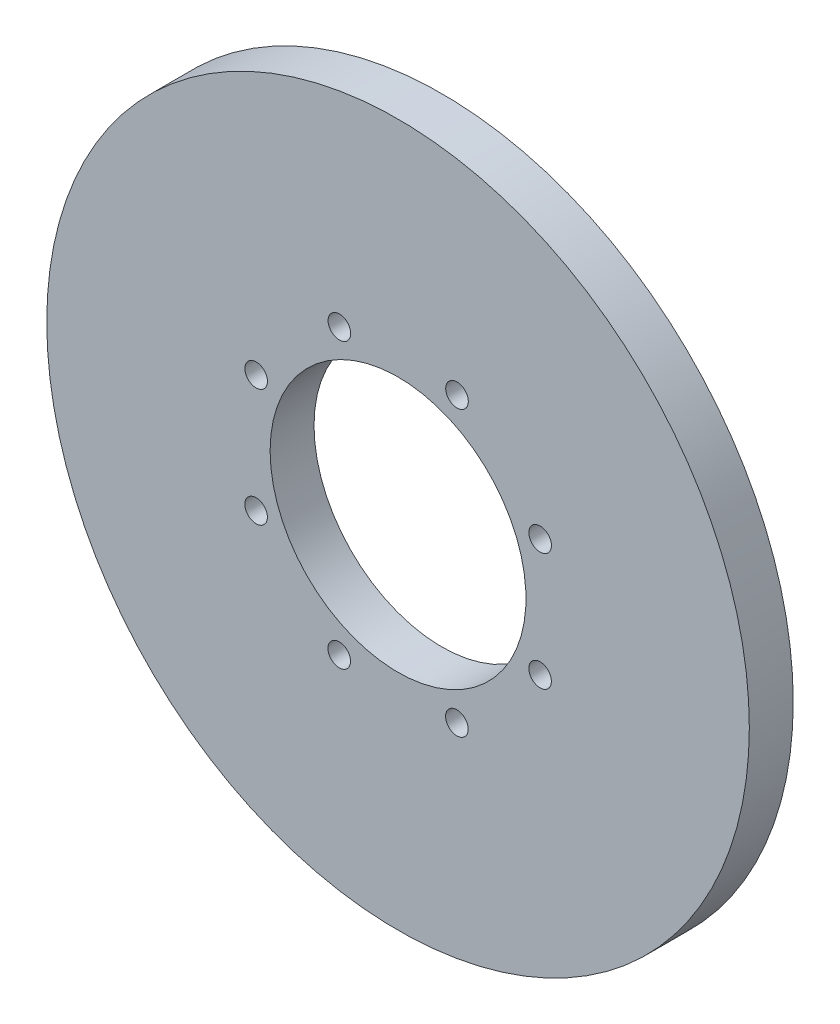
from build123d import *

# Parameters (mm, degrees)
SKETCH1_R                  = 152.4
BOSS_EXTRUDE1_DEPTH        = 19.05
SKETCH5_R                  = 55
CUT_EXTRUDE1_DEPTH         = 217.366407975
F_3_8_CLEARANCE_HOLE1_D    = 9.8044
NIPPLE_SOCKET_CLEARANCE_BY = 0.5


with BuildPart() as part:
    # Sketch1 → Boss-Extrude1 (new body)
    with BuildSketch(Plane.XY):
        with Locations(Location((0, 0, 0), (0, 0, 180))):
            Circle(SKETCH1_R)
    extrude(amount=BOSS_EXTRUDE1_DEPTH)

    # Sketch5 → Cut-Extrude1 (cut, through all)
    with BuildSketch(Plane(origin=(0, 0, 0), x_dir=(-1, 0, 0), z_dir=(0, 0, -1))):
        Circle(SKETCH5_R)
    extrude(amount=-CUT_EXTRUDE1_DEPTH, mode=Mode.SUBTRACT)

    # 3/8 Clearance Hole1 (through all)
    with Locations(Plane.XY.offset(19.05)):
        with Locations((25.523973959, -61.673028045), (61.624734649, -25.605296339), (61.648089668, 25.425534023), (25.580357962, 61.526294713), (-25.450472399, 61.549649732), (-61.55123309, 25.481918026), (-61.574588109, -25.548912335), (-25.506856403, -61.649673026)):
            Hole(F_3_8_CLEARANCE_HOLE1_D / 2)

    # nipple-socket-clearance: a curved face moved inward by 0.5
    add(Solid.thicken(part.faces().sort_by_distance((55, 0, 9.525))[0], -NIPPLE_SOCKET_CLEARANCE_BY), mode=Mode.SUBTRACT)


solid = part.part
